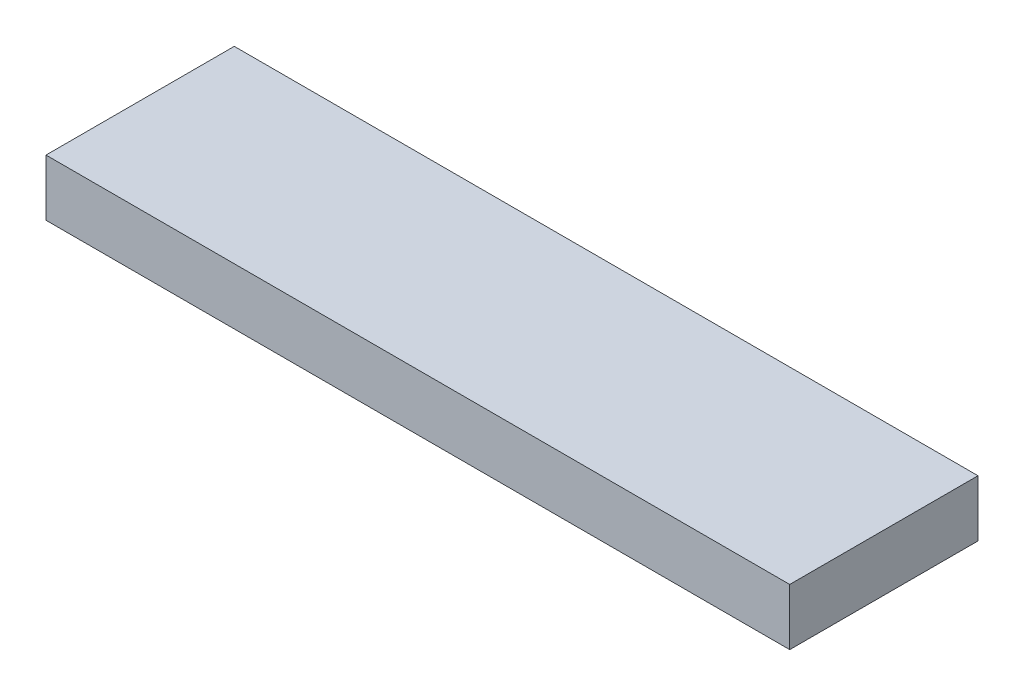
from build123d import *

# Parameters (mm, degrees)
SKETCH1_W           = 3950
SKETCH1_H           = 1000
BOSS_EXTRUDE1_DEPTH = 300


with BuildPart() as part:
    # Sketch1 → Boss-Extrude1 (new body)
    with BuildSketch(Plane(origin=(0, 0, 0), x_dir=(1, 0, 0), z_dir=(0, 1, 0))):
        with Locations((623.17961165, 142.354368932)):
            Rectangle(SKETCH1_W, SKETCH1_H)
    extrude(amount=BOSS_EXTRUDE1_DEPTH)


solid = part.part
